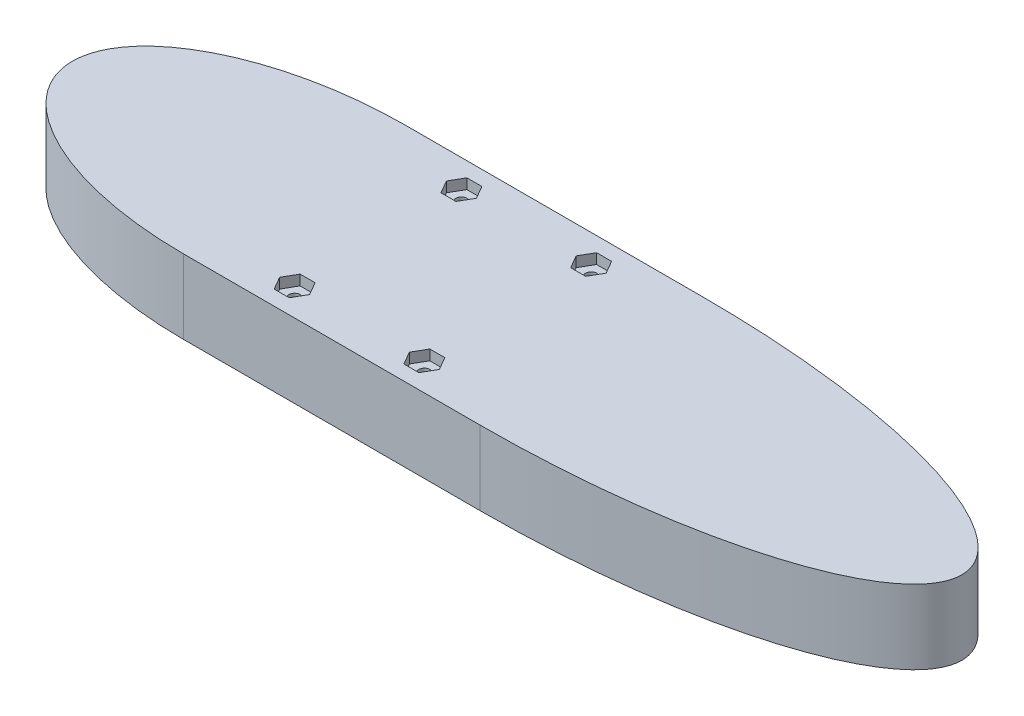
from build123d import *

# Parameters (mm, degrees)
BOSS_EXTRUDE1_DEPTH   = 25.4
SKETCH4_W             = 63.5
SKETCH4_H             = 76.2
CUT_EXTRUDE4_DEPTH    = 0.01
F_6_CLEARANCE_HOLE1_D = 3.7973
CUT_EXTRUDE5_DEPTH    = 3.5052


with BuildPart() as part:
    # Sketch1 → Boss-Extrude1 (new body)
    with BuildSketch(Plane(origin=(0, 0, 0), x_dir=(1, 0, 0), z_dir=(0, 1, 0))):
        with BuildLine():
            Line((76.2, 38.1), (177.8, 38.1))
            add(Edge.make_bspline(
                [(177.8, -38.1), (304.8, -38.1), (304.8, 0), (304.8, 38.1), (177.8, 38.1)],
                knots=[4.71238898, 4.71238898, 4.71238898, 6.283185307, 6.283185307, 7.853981634, 7.853981634, 7.853981634], degree=2, weights=[1, 0.707106781, 1, 0.707106781, 1]))
            Line((177.8, -38.1), (76.2, -38.1))
            add(Edge.make_bspline(
                [(76.2, 38.1), (0, 38.1), (0, 0), (0, -38.1), (76.2, -38.1)],
                knots=[4.71238898, 4.71238898, 4.71238898, 6.283185307, 6.283185307, 7.853981634, 7.853981634, 7.853981634], degree=2, weights=[1, 0.707106781, 1, 0.707106781, 1]))
        make_face()
    extrude(amount=BOSS_EXTRUDE1_DEPTH)

    # Sketch4 → Cut-Extrude4 (cut)
    with BuildSketch(Plane.XZ):
        with Locations((107.95, 0)):
            Rectangle(SKETCH4_W, SKETCH4_H)
    extrude(amount=-CUT_EXTRUDE4_DEPTH, mode=Mode.SUBTRACT)

    # #6 Clearance Hole1 (through all)
    with Locations(Plane(origin=(0, 25.4, 0), x_dir=(1, 0, 0), z_dir=(0, 1, 0))):
        with Locations((104.775, 28.575), (149.225, 28.575), (149.225, -28.575), (104.775, -28.575)):
            Hole(F_6_CLEARANCE_HOLE1_D / 2)

    # Sketch7 → Cut-Extrude5 (cut)
    with BuildSketch(Plane(origin=(0, 25.4, 0), x_dir=(1, 0, 0), z_dir=(0, 1, 0))):
        Polygon((144.092356107, 28.575), (146.658678053, 24.13), (151.791321947, 24.13), (154.357643893, 28.575), (151.791321947, 33.02), (146.658678053, 33.02), align=None)
        Polygon((144.092356107, -28.575), (146.658678053, -33.02), (151.791321947, -33.02), (154.357643893, -28.575), (151.791321947, -24.13), (146.658678053, -24.13), align=None)
        Polygon((99.642356107, -28.575), (102.208678053, -33.02), (107.341321947, -33.02), (109.907643893, -28.575), (107.341321947, -24.13), (102.208678053, -24.13), align=None)
        Polygon((99.642356107, 28.575), (102.208678053, 24.13), (107.341321947, 24.13), (109.907643893, 28.575), (107.341321947, 33.02), (102.208678053, 33.02), align=None)
    extrude(amount=-CUT_EXTRUDE5_DEPTH, mode=Mode.SUBTRACT)


solid = part.part
